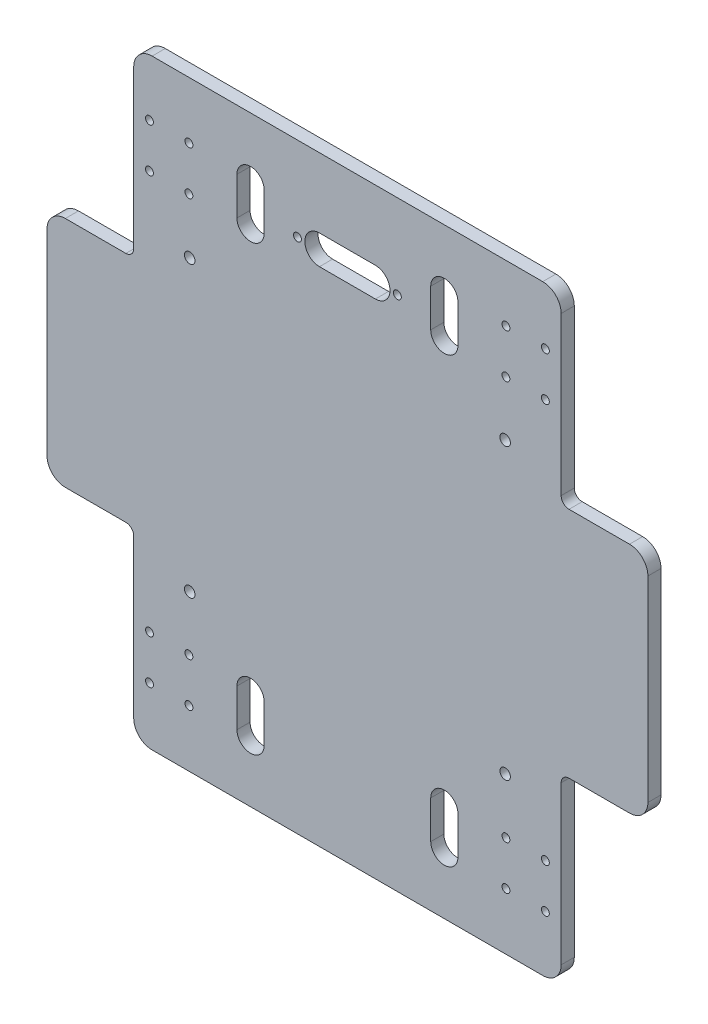
from build123d import *

# Parameters (mm, degrees)
SKETCH1_R           = 1.5
BOSS_EXTRUDE1_DEPTH = 5
SKETCH2_R           = 2
CUT_EXTRUDE1_DEPTH  = 5
FILLET1_R           = 7
FILLET2_R           = 7
FILLET3_R           = 3


with BuildPart() as part:
    # Sketch1 → Boss-Extrude1 (new body)
    with BuildSketch(Plane.XY):
        Polygon((33, 0), (195.6, 0), (195.6, -70), (228.6, -70), (228.6, -158.6), (195.6, -158.6), (195.6, -228.6), (33, -228.6), (33, -158.6), (0, -158.6), (0, -70), (33, -70), align=None)
        with Locations((95.3, -32)):
            Circle(SKETCH1_R, mode=Mode.SUBTRACT)
        with Locations((133.3, -32)):
            Circle(SKETCH1_R, mode=Mode.SUBTRACT)
        with Locations((39, -21.625)):
            Circle(SKETCH1_R, mode=Mode.SUBTRACT)
        with Locations((39, -38.375)):
            Circle(SKETCH1_R, mode=Mode.SUBTRACT)
        with Locations((54, -38.375)):
            Circle(SKETCH1_R, mode=Mode.SUBTRACT)
        with Locations((54, -21.625)):
            Circle(SKETCH1_R, mode=Mode.SUBTRACT)
        with Locations(Location((54, -206.975, 0), (0, 0, 180))):
            Circle(SKETCH1_R, mode=Mode.SUBTRACT)
        with Locations(Location((54, -190.225, 0), (0, 0, 180))):
            Circle(SKETCH1_R, mode=Mode.SUBTRACT)
        with Locations(Location((39, -190.225, 0), (0, 0, 180))):
            Circle(SKETCH1_R, mode=Mode.SUBTRACT)
        with Locations(Location((39, -206.975, 0), (0, 0, 180))):
            Circle(SKETCH1_R, mode=Mode.SUBTRACT)
        with Locations((174.6, -190.225)):
            Circle(SKETCH1_R, mode=Mode.SUBTRACT)
        with Locations((174.6, -206.975)):
            Circle(SKETCH1_R, mode=Mode.SUBTRACT)
        with Locations((189.6, -206.975)):
            Circle(SKETCH1_R, mode=Mode.SUBTRACT)
        with Locations((189.6, -190.225)):
            Circle(SKETCH1_R, mode=Mode.SUBTRACT)
        with Locations(Location((189.6, -38.375, 0), (0, 0, 180))):
            Circle(SKETCH1_R, mode=Mode.SUBTRACT)
        with Locations(Location((174.6, -38.375, 0), (0, 0, 180))):
            Circle(SKETCH1_R, mode=Mode.SUBTRACT)
        with Locations(Location((174.6, -21.625, 0), (0, 0, 180))):
            Circle(SKETCH1_R, mode=Mode.SUBTRACT)
        with Locations(Location((189.6, -21.625, 0), (0, 0, 180))):
            Circle(SKETCH1_R, mode=Mode.SUBTRACT)
        with BuildLine():
            Line((72.264776933, -37.198562168), (72.264776933, -22.801437832))
            ThreePointArc((72.264776933, -22.801437832), (77.438501315, -17.627713451), (82.612225696, -22.801437832))
            Line((82.612225696, -22.801437832), (82.612225696, -37.198562168))
            ThreePointArc((82.612225696, -37.198562168), (77.438501315, -42.372286549), (72.264776933, -37.198562168))
        make_face(mode=Mode.SUBTRACT)
        with BuildLine():
            Line((103.657302093, -26.446561828), (124.942697907, -26.446561828))
            ThreePointArc((124.942697907, -26.446561828), (130.496136079, -32), (124.942697907, -37.553438172))
            Line((124.942697907, -37.553438172), (103.657302093, -37.553438172))
            ThreePointArc((103.657302093, -37.553438172), (98.103863921, -32), (103.657302093, -26.446561828))
        make_face(mode=Mode.SUBTRACT)
        with BuildLine():
            Line((72.264776933, -191.401437832), (72.264776933, -205.798562168))
            ThreePointArc((72.264776933, -205.798562168), (77.438501315, -210.972286549), (82.612225696, -205.798562168))
            Line((82.612225696, -205.798562168), (82.612225696, -191.401437832))
            ThreePointArc((82.612225696, -191.401437832), (77.438501315, -186.227713451), (72.264776933, -191.401437832))
        make_face(mode=Mode.SUBTRACT)
        with BuildLine():
            Line((156.335223067, -191.401437832), (156.335223067, -205.798562168))
            ThreePointArc((156.335223067, -205.798562168), (151.161498685, -210.972286549), (145.987774304, -205.798562168))
            Line((145.987774304, -205.798562168), (145.987774304, -191.401437832))
            ThreePointArc((145.987774304, -191.401437832), (151.161498685, -186.227713451), (156.335223067, -191.401437832))
        make_face(mode=Mode.SUBTRACT)
        with BuildLine():
            Line((156.335223067, -37.198562168), (156.335223067, -22.801437832))
            ThreePointArc((156.335223067, -22.801437832), (151.161498685, -17.627713451), (145.987774304, -22.801437832))
            Line((145.987774304, -22.801437832), (145.987774304, -37.198562168))
            ThreePointArc((145.987774304, -37.198562168), (151.161498685, -42.372286549), (156.335223067, -37.198562168))
        make_face(mode=Mode.SUBTRACT)
    extrude(amount=BOSS_EXTRUDE1_DEPTH)

    # Sketch2 → Cut-Extrude1 (cut)
    with BuildSketch(Plane.XY.offset(5)):
        with Locations((54.3, -59.307305139)):
            Circle(SKETCH2_R)
        with Locations(Location((174.3, -59.307305139, 0), (0, 0, 180))):
            Circle(SKETCH2_R)
        with Locations((174.3, -169.292694861)):
            Circle(SKETCH2_R)
        with Locations(Location((54.3, -169.292694861, 0), (0, 0, 180))):
            Circle(SKETCH2_R)
    extrude(amount=-CUT_EXTRUDE1_DEPTH, mode=Mode.SUBTRACT)

    # Fillet1
    fillet1_edges = [part.edges().sort_by_distance(p)[0] for p in [
        (33, 0, 2.5),
        (195.6, 0, 2.5),
        (228.6, -70, 2.5),
        (228.6, -158.6, 2.5),
        (0, -158.6, 2.5),
        (0, -70, 2.5),
    ]]
    fillet(fillet1_edges, radius=FILLET1_R)

    # Fillet2
    fillet2_edges = [part.edges().sort_by_distance(p)[0] for p in [
        (195.6, -228.6, 2.5),
        (33, -228.6, 2.5),
    ]]
    fillet(fillet2_edges, radius=FILLET2_R)

    # Fillet3
    fillet3_edges = [part.edges().sort_by_distance(p)[0] for p in [
        (33, -70, 2.5),
        (195.6, -70, 2.5),
        (195.6, -158.6, 2.5),
        (33, -158.6, 2.5),
    ]]
    fillet(fillet3_edges, radius=FILLET3_R)


solid = part.part
